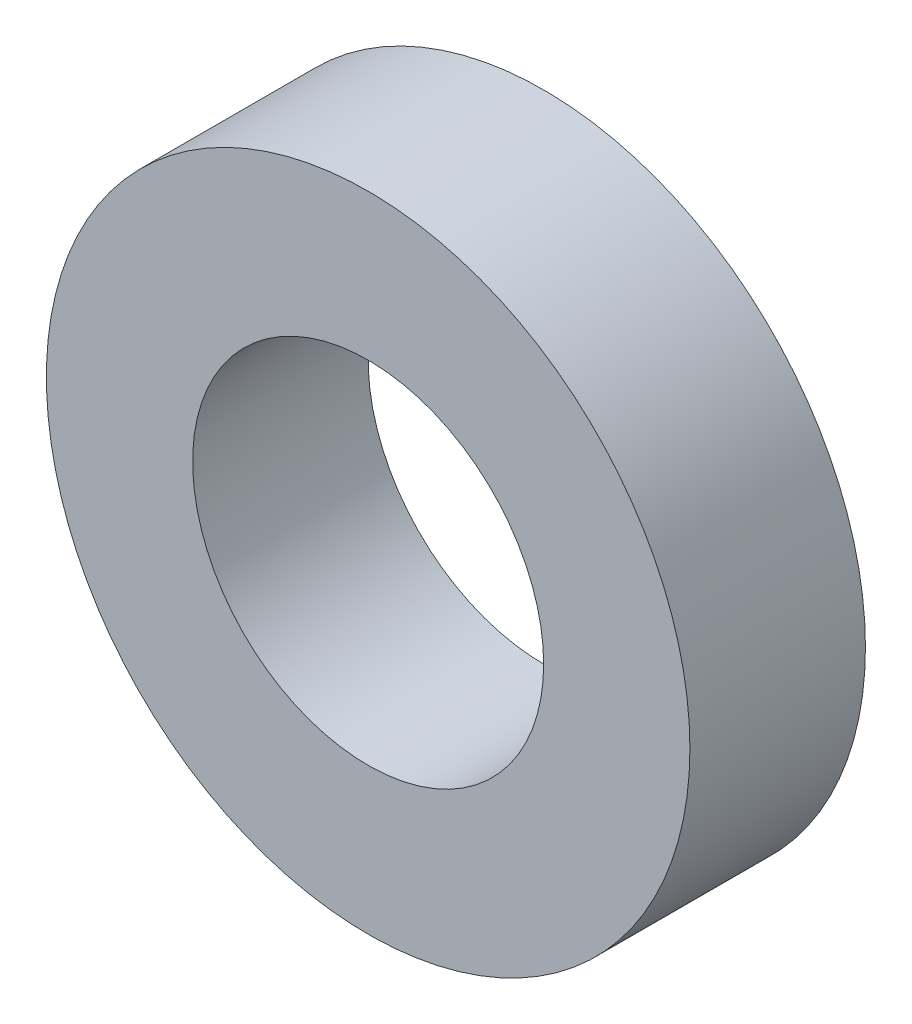
from build123d import *

# Parameters (mm, degrees)
CROQUIS1_R              = 5.5
CROQUIS1_R_2            = 3
SALIENTE_EXTRUIR1_DEPTH = 3


with BuildPart() as part:
    # Croquis1 → Saliente-Extruir1 (new body)
    with BuildSketch(Plane.XY):
        Circle(CROQUIS1_R)
        Circle(CROQUIS1_R_2, mode=Mode.SUBTRACT)
    extrude(amount=SALIENTE_EXTRUIR1_DEPTH)


solid = part.part
